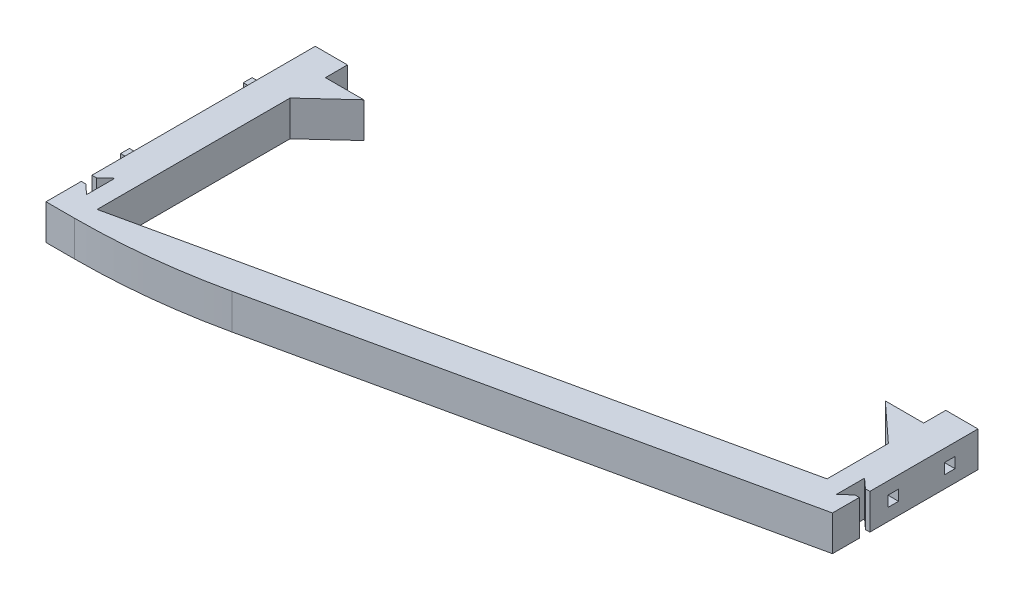
from build123d import *

# Parameters (mm, degrees)
P_IDAT_VYSUNUT_M1_DEPTH  = 8
ODEBRAT_VYSUNUT_M1_DEPTH = 165.210299616
SKICA3_W                 = 2
SKICA3_H                 = 2
P_IDAT_VYSUNUT_M2_DEPTH  = 4
SKICA5_W                 = 16
SKICA5_H                 = 8
P_IDAT_VYSUNUT_M3_DEPTH  = 8
ODEBRAT_VYSUNUT_M4_DEPTH = 165.210299616
SKICA4_W                 = 2.4
SKICA4_H                 = 2.4
ODEBRAT_VYSUNUT_M2_DEPTH = 4.4
ODEBRAT_VYSUNUT_M5_DEPTH = 165.210299616
ODEBRAT_VYSUNUT_M6_DEPTH = 165.210299616
ZAOBLIT1_R               = 150


with BuildPart() as part:
    # Skica1 → Přidat vysunutím1 (new body)
    with BuildSketch(Plane(origin=(0, 0, 0), x_dir=(1, 0, 0), z_dir=(0, 1, 0))):
        Polygon((0, 0), (0, -66), (150.15, -32.97), (150.15, 0), (142.85, 0), (142.85, -26.8965309), (7.3, -56.714822608), (7.3, 0), align=None)
    extrude(amount=P_IDAT_VYSUNUT_M1_DEPTH)

    # Skica2 → Odebrat vysunutím1 (cut, through all)
    with BuildSketch(Plane(origin=(0, 8, 0), x_dir=(1, 0, 0), z_dir=(0, 1, 0))):
        Polygon((0, -50.6), (1, -50.6), (3.2, -48.6), (3.2, -55), (1, -53), (0, -53), align=None)
    extrude(amount=-ODEBRAT_VYSUNUT_M1_DEPTH, mode=Mode.SUBTRACT)

    # Skica3 → Přidat vysunutím2 (add)
    with BuildSketch(Plane.ZY):
        with Locations((11.3, 4)):
            Rectangle(SKICA3_W, SKICA3_H)
        with Locations((39.1, 4)):
            Rectangle(SKICA3_W, SKICA3_H)
    extrude(amount=P_IDAT_VYSUNUT_M2_DEPTH)

    # Skica5 → Přidat vysunutím3 (add)
    with BuildSketch(Plane(origin=(0, 8, 0), x_dir=(1, 0, 0), z_dir=(0, 1, 0))):
        with Locations((8, -9)):
            Rectangle(SKICA5_W, SKICA5_H)
        with Locations((142.15, -9)):
            Rectangle(SKICA5_W, SKICA5_H)
    extrude(amount=-P_IDAT_VYSUNUT_M3_DEPTH)

    # Skica7 → Odebrat vysunutím4 (cut, through all)
    with BuildSketch(Plane.XZ):
        Polygon((7.3, 13), (16, 5), (16, 13), align=None)
        Polygon((134.15, 5), (134.15, 13), (142.85, 13), align=None)
    extrude(amount=-ODEBRAT_VYSUNUT_M4_DEPTH, mode=Mode.SUBTRACT)

    # Skica4 → Odebrat vysunutím2 (cut)
    with BuildSketch(Plane(origin=(150.15, 0, 0), x_dir=(0, 0, -1), z_dir=(1, 0, 0))):
        with Locations((-19.2, 4)):
            Rectangle(SKICA4_W, SKICA4_H)
        with Locations((-6.4, 4)):
            Rectangle(SKICA4_W, SKICA4_H)
    extrude(amount=-ODEBRAT_VYSUNUT_M2_DEPTH, mode=Mode.SUBTRACT)

    # Skica8 → Odebrat vysunutím5 (cut, through all)
    with BuildSketch(Plane(origin=(0, 8, 0), x_dir=(1, 0, 0), z_dir=(0, 1, 0))):
        Polygon((150.15, -24.5), (149.15, -24.5), (146.95, -22.5), (146.95, -28.9), (149.15, -26.9), (150.15, -26.9), align=None)
    extrude(amount=-ODEBRAT_VYSUNUT_M5_DEPTH, mode=Mode.SUBTRACT)

    # Skica9 → Odebrat vysunutím6 (cut, through all)
    with BuildSketch(Plane(origin=(0, 8, 0), x_dir=(1, 0, 0), z_dir=(0, 1, 0))):
        Polygon((0, -61), (22.729336966, -61), (0, -66), align=None)
    extrude(amount=-ODEBRAT_VYSUNUT_M6_DEPTH, mode=Mode.SUBTRACT)

    # Zaoblit1
    zaoblit1_edges = [part.edges().sort_by_distance(p)[0] for p in [
        (22.729336966, 4, 61),
    ]]
    fillet(zaoblit1_edges, radius=ZAOBLIT1_R)


solid = part.part
